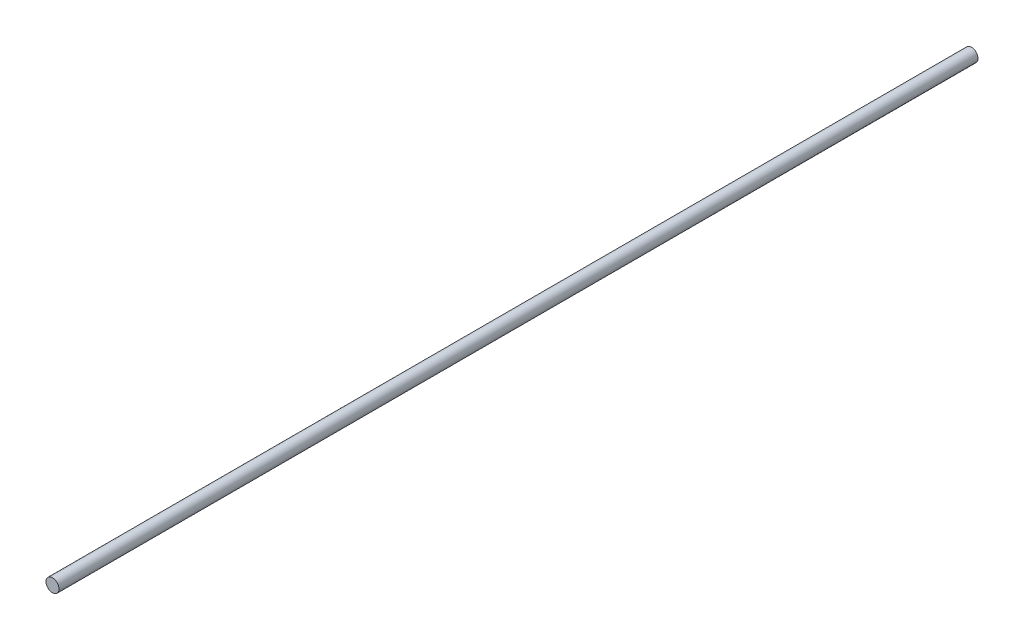
from build123d import *

# Parameters (mm, degrees)
SKETCH1_R           = 6.35
BOSS_EXTRUDE1_DEPTH = 897.135388694


with BuildPart() as part:
    # Sketch1 → Boss-Extrude1 (new body)
    with BuildSketch(Plane.XY):
        Circle(SKETCH1_R)
    extrude(amount=BOSS_EXTRUDE1_DEPTH)


solid = part.part
